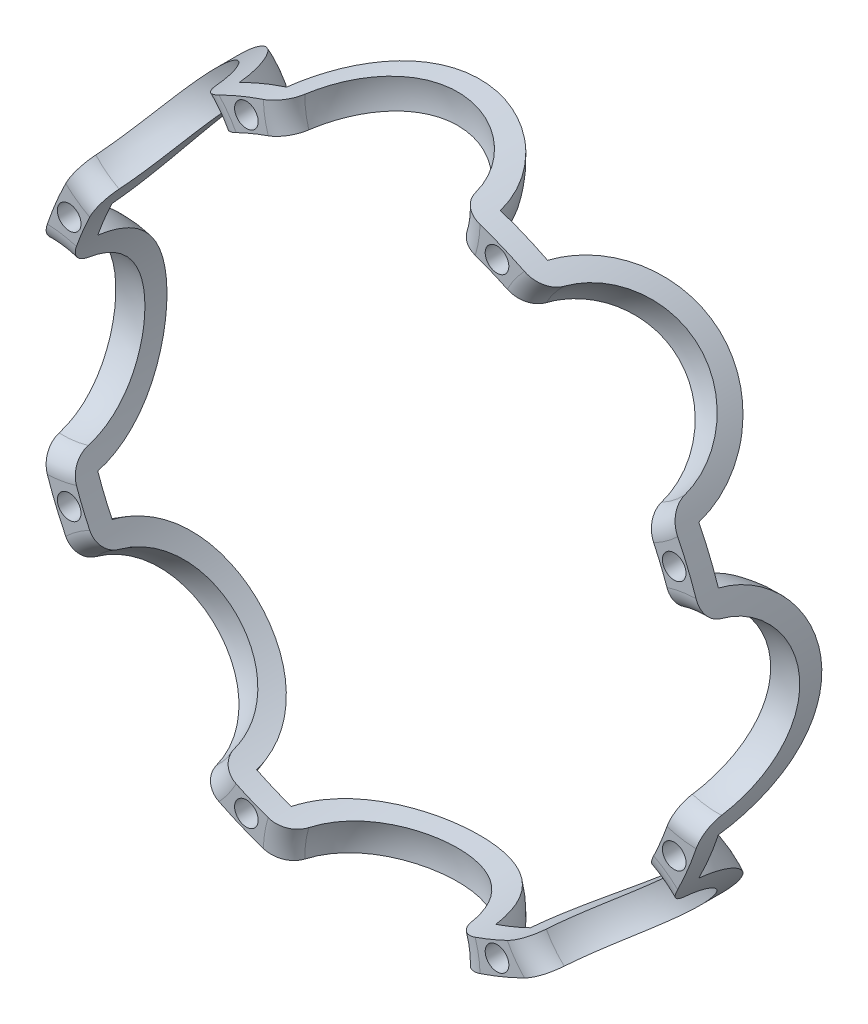
from build123d import *

# Parameters (mm, degrees)
SKETCH1_R           = 14.461538463
SKETCH1_R_2         = 13.23076923
BOSS_EXTRUDE1_DEPTH = 9.846153846
CIRPATTERN1_COUNT   = 8
SHELL1_T            = -0.923076923
SKETCH3_R           = 0.5
CUT_EXTRUDE1_DEPTH  = 9.846153846
FILLET1_R           = 1


with BuildPart() as part:
    # Sketch1 → Boss-Extrude1 (new body)
    with BuildSketch(Plane.XY):
        Circle(SKETCH1_R)
        Circle(SKETCH1_R_2, mode=Mode.SUBTRACT)
    extrude(amount=BOSS_EXTRUDE1_DEPTH)

    # Sketch2 → Cut-Revolve1 (revolve, cut)
    with BuildSketch(Plane.XY.offset(9.846153846)):
        with BuildLine():
            Line((0, 17.538461538), (0, 10.153846152))
            ThreePointArc((0, 10.153846152), (3.692307693, 13.846153845), (0, 17.538461538))
        make_face()
    cut_revolve1 = revolve(axis=Axis((0, 17.538461538, 9.846153846), (0, -1, 0)), mode=Mode.SUBTRACT)

    # CirPattern1: Cut-Revolve1 ×8 about axis
    cirpattern1_axis = Axis((0, 0, 0), (0, 0, 1))
    for i in range(1, CIRPATTERN1_COUNT):
        add(cut_revolve1.rotate(cirpattern1_axis, i * 360 / CIRPATTERN1_COUNT), mode=Mode.SUBTRACT)

    # Shell1
    shell1_openings = [part.faces().sort_by_distance(p)[0] for p in [
        (-14.461538463, 0, 4.923076923),
        (-14.052504386, 0, 0),
        (-13.23076923, 0, 4.923076923),
    ]]
    offset(amount=SHELL1_T, openings=shell1_openings)

    # Sketch3 → Cut-Extrude1 (cut)
    with BuildSketch(Plane.XY.offset(9.846153846)):
        with Locations((5.298693678, 12.792178141)):
            Circle(SKETCH3_R)
        with Locations((12.792178141, 5.298693678)):
            Circle(SKETCH3_R)
        with Locations((12.792178141, -5.298693678)):
            Circle(SKETCH3_R)
        with Locations((5.298693678, -12.792178141)):
            Circle(SKETCH3_R)
        with Locations((-5.298693678, -12.792178141)):
            Circle(SKETCH3_R)
        with Locations((-12.792178141, -5.298693678)):
            Circle(SKETCH3_R)
        with Locations((-12.792178141, 5.298693678)):
            Circle(SKETCH3_R)
        with Locations((-5.298693678, 12.792178141)):
            Circle(SKETCH3_R)
    extrude(amount=-CUT_EXTRUDE1_DEPTH, mode=Mode.SUBTRACT)

    # Fillet1
    fillet1_edges = [part.edges().sort_by_distance(p)[0] for p in [
        (-12.035560881, -6.859194758, 9.846153846),
        (-6.859194758, -12.035560881, 9.846153846),
        (-13.360609842, 3.660243587, 9.846153846),
        (-13.360609842, -3.660243587, 9.846153846),
        (-6.859194758, 12.035560881, 9.846153846),
        (-12.035560881, 6.859194758, 9.846153846),
        (-3.660243587, 13.360609842, 9.846153846),
        (3.660243587, 13.360609842, 9.846153846),
        (6.859194758, 12.035560881, 9.846153846),
        (12.035560881, 6.859194758, 9.846153846),
        (13.360609842, 3.660243587, 9.846153846),
        (13.360609842, -3.660243587, 9.846153846),
        (12.035560881, -6.859194758, 9.846153846),
        (6.859194758, -12.035560881, 9.846153846),
        (3.660243587, -13.360609842, 9.846153846),
        (-3.660243587, -13.360609842, 9.846153846),
    ]]
    fillet(fillet1_edges, radius=FILLET1_R)


solid = part.part
